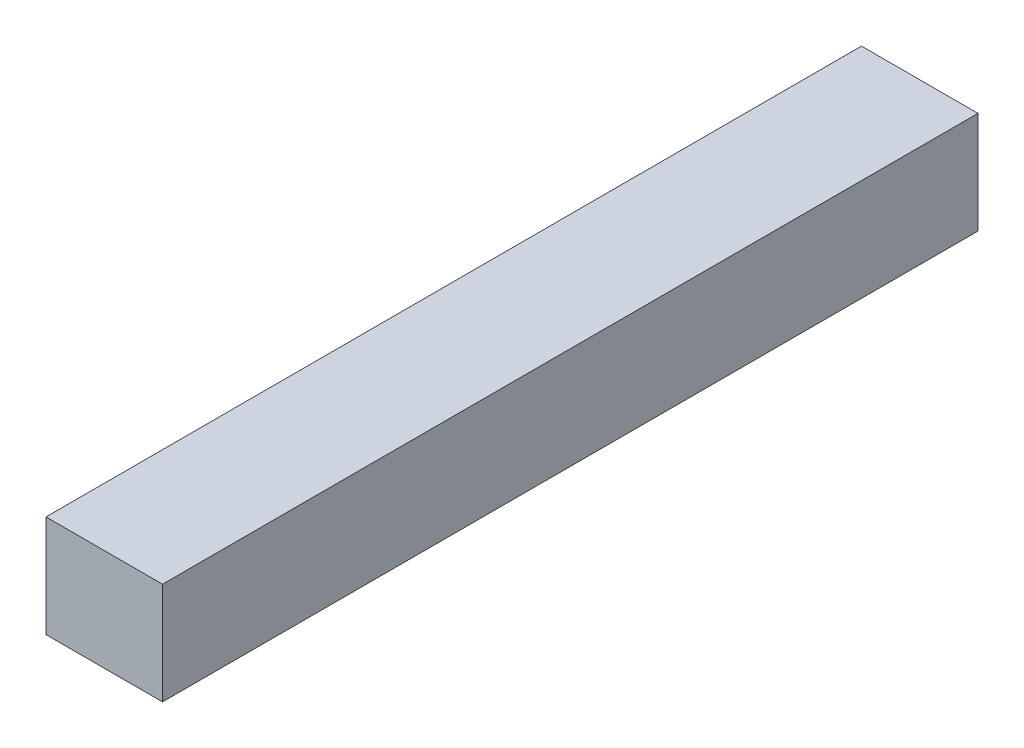
from build123d import *

# Parameters (mm, degrees)
SKETCH1_W           = 8
SKETCH1_H           = 7
BOSS_EXTRUDE1_DEPTH = 56


with BuildPart() as part:
    # Sketch1 → Boss-Extrude1 (new body)
    with BuildSketch(Plane.XY):
        Rectangle(SKETCH1_W, SKETCH1_H)
    extrude(amount=BOSS_EXTRUDE1_DEPTH)


solid = part.part
